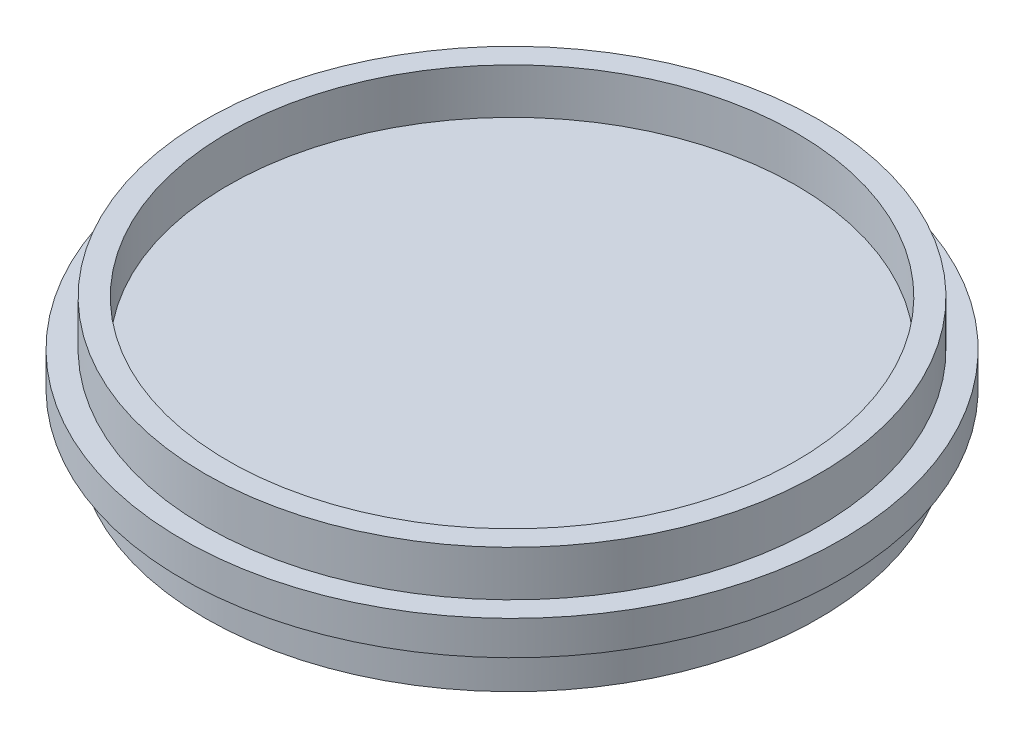
from build123d import *

# Parameters (mm, degrees)
SKETCH1_W           = 127.635
SKETCH1_H           = 127.635
BOSS_EXTRUDE1_DEPTH = 9.525
SKETCH12_R          = 92.075
BOSS_EXTRUDE2_DEPTH = 9.525
SKETCH30_R          = 85.725
SKETCH30_R_2        = 79.375
BOSS_EXTRUDE3_DEPTH = 12.7


with BuildPart() as part:
    # Sketch1 → Boss-Extrude1 (new body)
    with BuildSketch(Plane(origin=(0, 0, 0), x_dir=(1, 0, 0), z_dir=(0, 1, 0))):
        with Locations((63.8175, 63.8175)):
            Rectangle(SKETCH1_W, SKETCH1_H)
    extrude(amount=BOSS_EXTRUDE1_DEPTH)

    # Sketch12 → Boss-Extrude2 (add)
    with BuildSketch(Plane.XZ):
        with Locations(Location((63.8175, -63.8175, 0), (0, 0, 270))):
            Circle(SKETCH12_R)
    extrude(amount=-BOSS_EXTRUDE2_DEPTH)

    # Sketch30 → Boss-Extrude3 (add)
    with BuildSketch(Plane.XZ):
        with Locations(Location((63.8175, -63.8175, 0), (0, 0, 270))):
            Circle(SKETCH30_R)
        with Locations(Location((63.8175, -63.8175, 0), (0, 0, 270))):
            Circle(SKETCH30_R_2, mode=Mode.SUBTRACT)
    boss_extrude3 = extrude(amount=BOSS_EXTRUDE3_DEPTH)

    # Mirror1: Boss-Extrude3 across plane
    add(boss_extrude3.mirror(Plane.ZX.offset(4.7625)))


solid = part.part
